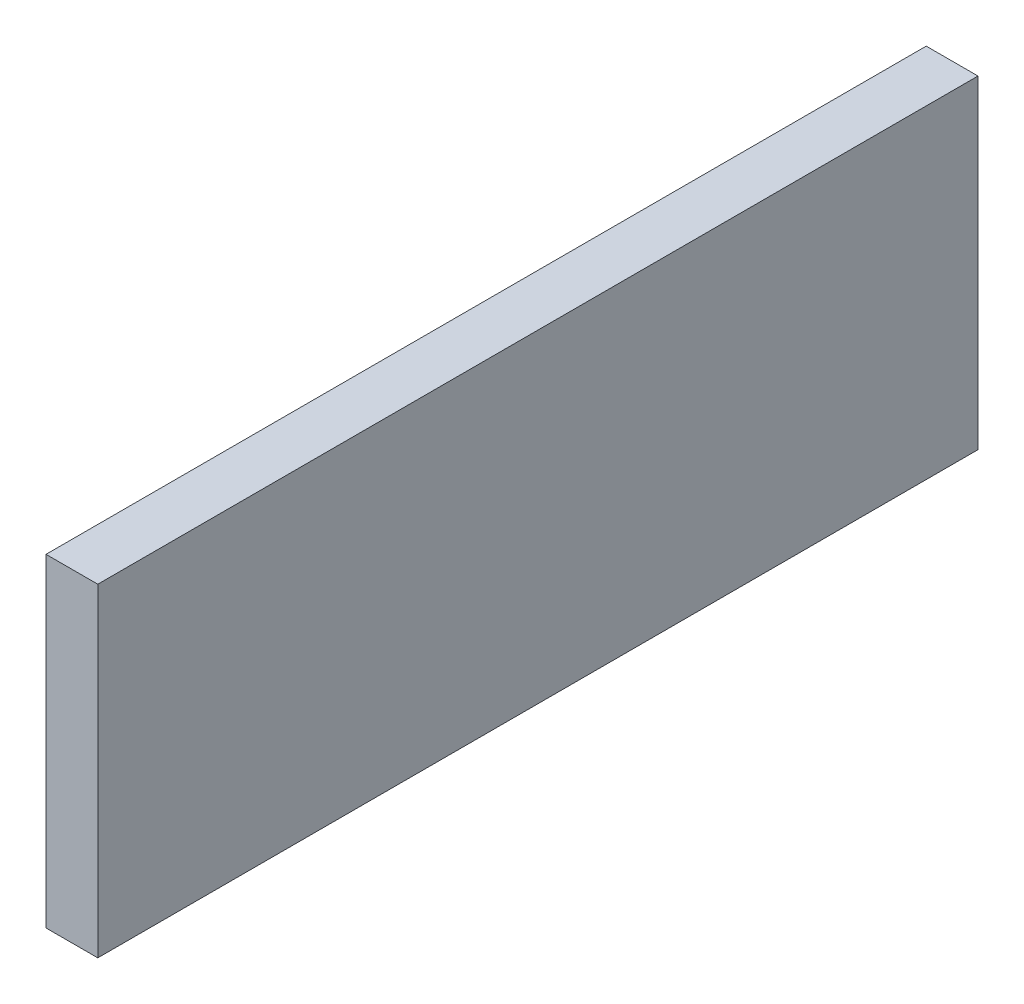
from build123d import *

# Parameters (mm, degrees)
SKETCH1_W           = 68
SKETCH1_H           = 25
BOSS_EXTRUDE1_DEPTH = 4


with BuildPart() as part:
    # Sketch1 → Boss-Extrude1 (new body)
    with BuildSketch(Plane(origin=(0, 0, 0), x_dir=(0, 0, -1), z_dir=(1, 0, 0))):
        with Locations((7.512195122, -0.487804878)):
            Rectangle(SKETCH1_W, SKETCH1_H)
    extrude(amount=BOSS_EXTRUDE1_DEPTH)


solid = part.part
